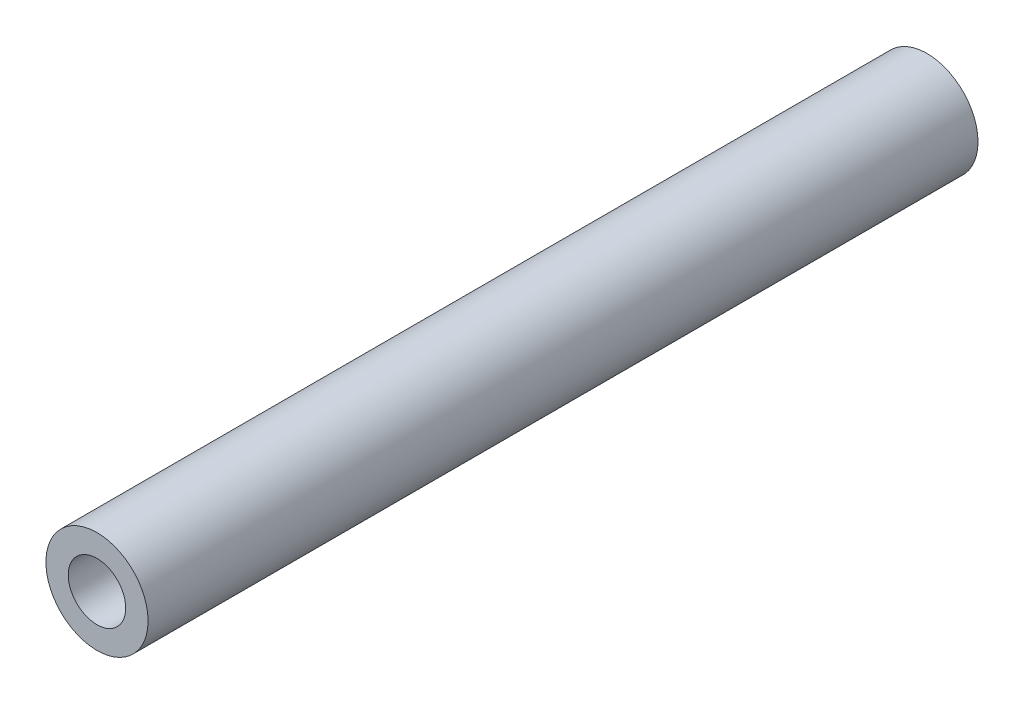
from build123d import *

# Parameters (mm, degrees)
TIE_TUBE_START = -32
SKETCH_1_R     = 4
SKETCH_1_R_2   = 2.25
TIE_TUBE_DEPTH = 65


with BuildPart() as part:
    # Эскиз1 → Tie_tube (new body)
    with BuildSketch(Plane.XY.offset(TIE_TUBE_START)):
        Circle(SKETCH_1_R)
        Circle(SKETCH_1_R_2, mode=Mode.SUBTRACT)
    extrude(amount=TIE_TUBE_DEPTH)


solid = part.part
